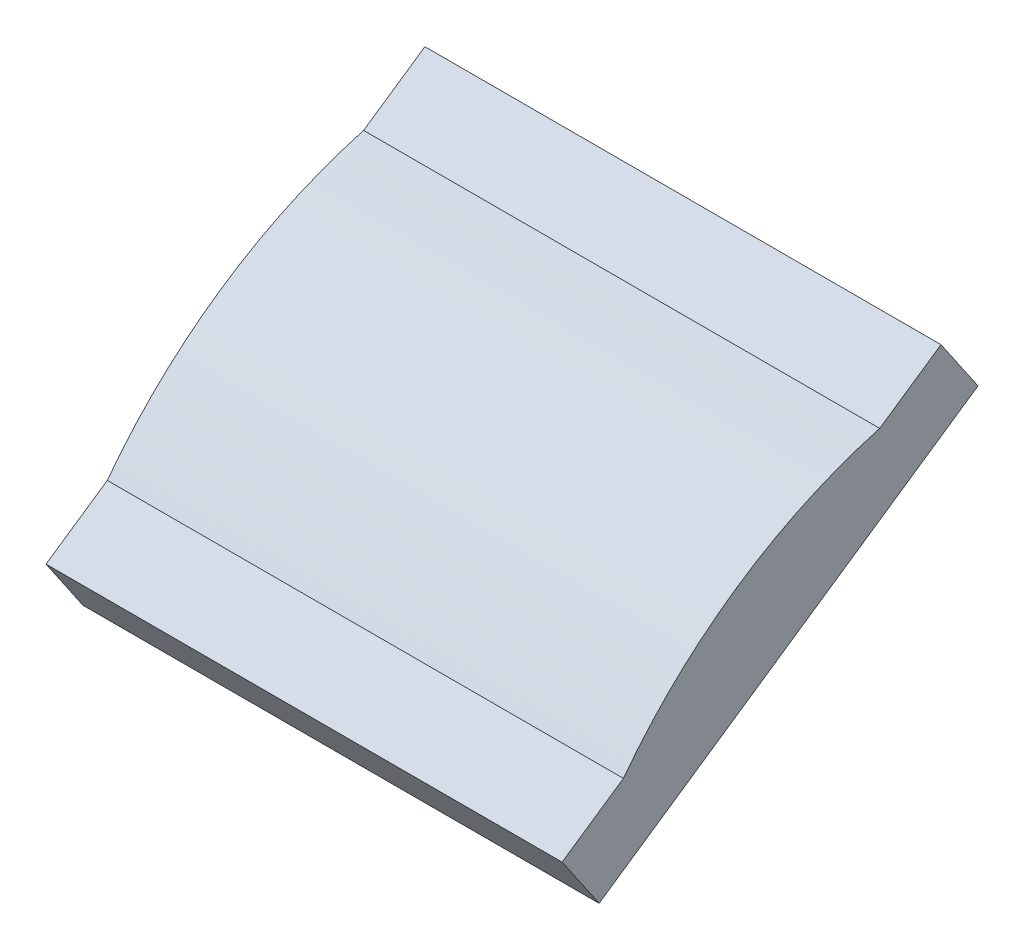
from build123d import *

# Parameters (mm, degrees)
ESBO_O2_R                = 2.5
RESSALTO_EXTRUS_O2_DEPTH = 5
RESSALTO_EXTRUS_O3_DEPTH = 173.55
RESSALTO_EXTRUS_O4_DEPTH = 276.45


with BuildPart() as part:
    # Esboço2 → Ressalto-extrusão2 (new body)
    # profile 1 of 2: a face of its own
    with BuildSketch(Plane(origin=(0, 0, 0), x_dir=(0, 0, -1), z_dir=(1, 0, 0))):
        with BuildLine():
            Line((27.044906217, -7.661000215), (16.526427317, 22.814878798))
            Line((16.526427317, 22.814878798), (-11.047978387, 3.985533348))
            Line((-11.047978387, 3.985533348), (-37.30105887, -13.941537387))
            ThreePointArc((-37.30105887, -13.941537387), (-45.271053286, -17.947334992), (-36.526951093, -16.184410638))
            Line((-36.526951093, -16.184410638), (24.022721227, -12.209541831))
            ThreePointArc((24.022721227, -12.209541831), (32.261148153, -14.405110119), (27.044906217, -7.661000215))
        make_face()
        with Locations((-41.017286054, -16.479185022)):
            Circle(ESBO_O2_R, mode=Mode.SUBTRACT)
        with Locations((28.513056188, -11.914767447)):
            Circle(ESBO_O2_R, mode=Mode.SUBTRACT)
    # profile 2 of 2: a face of its own
    with BuildSketch(Plane(origin=(0, 0, 0), x_dir=(0, 0, -1), z_dir=(1, 0, 0))):
        Polygon((-11.047978387, 3.985533348), (16.526427317, 22.814878798), (92.896691956, 113.919418087), (95.787558299, 117.368025311), (92.071137464, 114.830661289), (1.415245238, 52.935894913), (-2.301175596, 50.398530891), (-3.134557188, 45.976373598), align=None)
    extrude(amount=RESSALTO_EXTRUS_O2_DEPTH)



with BuildPart() as body_2:
    # Esboço3 → Ressalto-extrusão3 (new body)
    with BuildSketch(Plane(origin=(5, 0, 0), x_dir=(0, 0, -1), z_dir=(1, 0, 0))):
        with BuildLine():
            Line((-2.301175596, 50.398530891), (-234.560960335, -108.175443308))
            Line((-234.560960335, -108.175443308), (-266.813676347, -60.935605143))
            Line((-266.813676347, -60.935605143), (-213.363286032, -24.442671921))
            ThreePointArc((-213.363286032, -24.442671921), (-114.312493315, 70.398103063), (10.084451972, 128.114930253))
            Line((10.084451972, 128.114930253), (63.534842287, 164.607863476))
            Line((63.534842287, 164.607863476), (95.787558299, 117.368025311))
            Line((95.787558299, 117.368025311), (-2.301175596, 50.398530891))
        make_face()
    extrude(amount=RESSALTO_EXTRUS_O3_DEPTH)


with BuildPart() as part_1:
    add(part.part)

    add(body_2.part)  # Ressalto-extrusão4 merges body 2
    # Esboço4 → Ressalto-extrusão4 (add)
    with BuildSketch(Plane.ZY.offset(-5)):
        with BuildLine():
            Line((234.560960335, -108.175443308), (-95.787558299, 117.368025311))
            Line((-95.787558299, 117.368025311), (-63.534842287, 164.607863476))
            Line((-63.534842287, 164.607863476), (-10.084451972, 128.114930253))
            ThreePointArc((-10.084451972, 128.114930253), (114.312493315, 70.398103063), (213.363286032, -24.442671921))
            Line((213.363286032, -24.442671921), (266.813676347, -60.935605143))
            Line((266.813676347, -60.935605143), (234.560960335, -108.175443308))
        make_face()
    extrude(amount=RESSALTO_EXTRUS_O4_DEPTH)


solid = part_1.part
